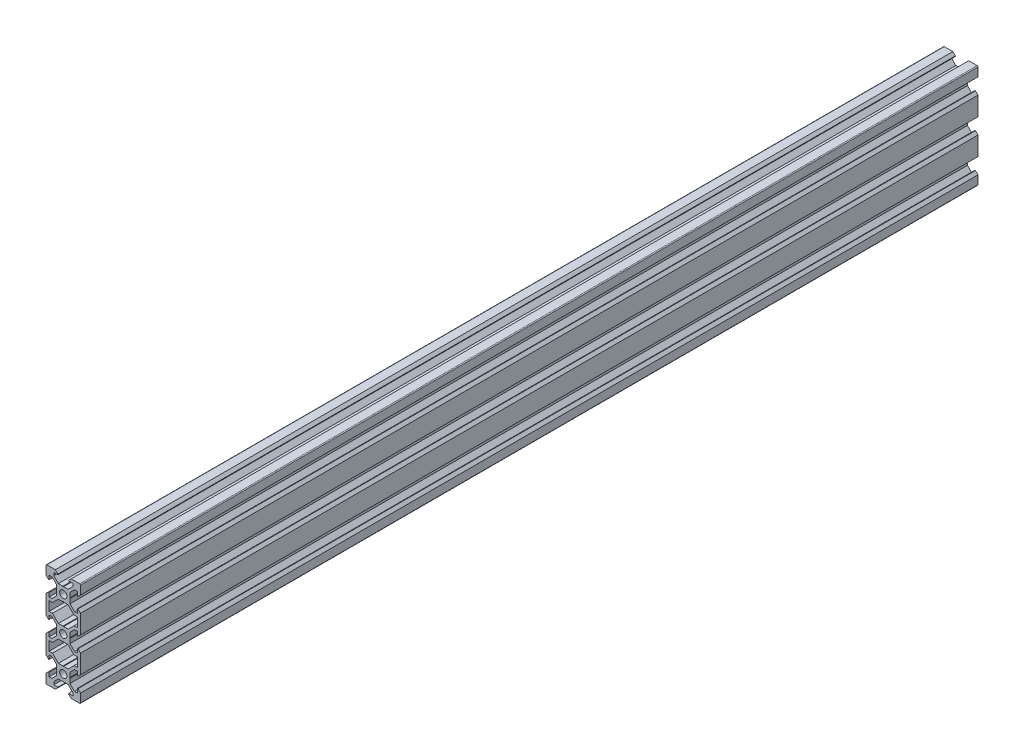
from build123d import *

# Parameters (mm, degrees)
BOSS_EXTRU_1_DEPTH = 520


with BuildPart() as part:
    # Esquisse1 → Boss.-Extru.1 (new body)
    with BuildSketch(Plane.XY):
        with BuildLine():
            Line((-9.5, 10), (-4.58, 10))
            Line((-4.58, 10), (-3.125, 8.545))
            Line((-3.125, 8.545), (-3.125, 8.2))
            Line((-3.125, 8.2), (-5.5, 8.2))
            Line((-5.5, 8.2), (-5.5, 6.560660172))
            Line((-5.5, 6.560660172), (-2.839339828, 3.9))
            Line((-2.839339828, 3.9), (-0.21, 3.9))
            Line((-0.21, 3.9), (0, 3.69))
            Line((0, 3.69), (0, 2.1))
            ThreePointArc((0, 2.1), (-2.1, 0), (0, -2.1))
            Line((0, -2.1), (0, -3.69))
            Line((0, -3.69), (-0.21, -3.9))
            Line((-0.21, -3.9), (-2.839339828, -3.9))
            Line((-2.839339828, -3.9), (-6.239339828, -7.3))
            Line((-6.239339828, -7.3), (-8.2, -7.3))
            Line((-8.2, -7.3), (-8.2, -12.7))
            Line((-8.2, -12.7), (-6.239339828, -12.7))
            Line((-6.239339828, -12.7), (-2.839339828, -16.1))
            Line((-2.839339828, -16.1), (-0.21, -16.1))
            Line((-0.21, -16.1), (0, -16.31))
            Line((0, -16.31), (0, -17.9))
            ThreePointArc((0, -17.9), (-2.1, -20), (0, -22.1))
            Line((0, -22.1), (0, -23.69))
            Line((0, -23.69), (-0.21, -23.9))
            Line((-0.21, -23.9), (-2.839339828, -23.9))
            Line((-2.839339828, -23.9), (-6.239339828, -27.3))
            Line((-6.239339828, -27.3), (-8.2, -27.3))
            Line((-8.2, -27.3), (-8.2, -32.7))
            Line((-8.2, -32.7), (-6.239339828, -32.7))
            Line((-6.239339828, -32.7), (-2.839339828, -36.1))
            Line((-2.839339828, -36.1), (-0.21, -36.1))
            Line((-0.21, -36.1), (0, -36.31))
            Line((0, -36.31), (0, -37.9))
            ThreePointArc((0, -37.9), (-2.1, -40), (0, -42.1))
            Line((0, -42.1), (0, -43.69))
            Line((0, -43.69), (-0.21, -43.9))
            Line((-0.21, -43.9), (-2.839339828, -43.9))
            Line((-2.839339828, -43.9), (-5.5, -46.560660172))
            Line((-5.5, -46.560660172), (-5.5, -48.2))
            Line((-5.5, -48.2), (-3.125, -48.2))
            Line((-3.125, -48.2), (-3.125, -48.545))
            Line((-3.125, -48.545), (-4.58, -50))
            Line((-4.58, -50), (-9.5, -50))
            ThreePointArc((-9.5, -50), (-9.853553391, -49.853553391), (-10, -49.5))
            Line((-10, -49.5), (-10, -44.58))
            Line((-10, -44.58), (-8.545, -43.125))
            Line((-8.545, -43.125), (-8.2, -43.125))
            Line((-8.2, -43.125), (-8.2, -45.5))
            Line((-8.2, -45.5), (-6.560660172, -45.5))
            Line((-6.560660172, -45.5), (-3.9, -42.839339828))
            Line((-3.9, -42.839339828), (-3.9, -40.21))
            Line((-3.9, -40.21), (-3.69, -40))
            Line((-3.69, -40), (-3.9, -39.79))
            Line((-3.9, -39.79), (-3.9, -37.160660172))
            Line((-3.9, -37.160660172), (-6.560660172, -34.5))
            Line((-6.560660172, -34.5), (-8.2, -34.5))
            Line((-8.2, -34.5), (-8.2, -36.875))
            Line((-8.2, -36.875), (-8.545, -36.875))
            Line((-8.545, -36.875), (-10, -35.42))
            Line((-10, -35.42), (-10, -24.58))
            Line((-10, -24.58), (-8.545, -23.125))
            Line((-8.545, -23.125), (-8.2, -23.125))
            Line((-8.2, -23.125), (-8.2, -25.5))
            Line((-8.2, -25.5), (-6.560660172, -25.5))
            Line((-6.560660172, -25.5), (-3.9, -22.839339828))
            Line((-3.9, -22.839339828), (-3.9, -20.21))
            Line((-3.9, -20.21), (-3.69, -20))
            Line((-3.69, -20), (-3.9, -19.79))
            Line((-3.9, -19.79), (-3.9, -17.160660172))
            Line((-3.9, -17.160660172), (-6.560660172, -14.5))
            Line((-6.560660172, -14.5), (-8.2, -14.5))
            Line((-8.2, -14.5), (-8.2, -16.875))
            Line((-8.2, -16.875), (-8.545, -16.875))
            Line((-8.545, -16.875), (-10, -15.42))
            Line((-10, -15.42), (-10, -4.58))
            Line((-10, -4.58), (-8.545, -3.125))
            Line((-8.545, -3.125), (-8.2, -3.125))
            Line((-8.2, -3.125), (-8.2, -5.5))
            Line((-8.2, -5.5), (-6.560660172, -5.5))
            Line((-6.560660172, -5.5), (-3.9, -2.839339828))
            Line((-3.9, -2.839339828), (-3.9, -0.21))
            Line((-3.9, -0.21), (-3.69, 0))
            Line((-3.69, 0), (-3.9, 0.21))
            Line((-3.9, 0.21), (-3.9, 2.839339828))
            Line((-3.9, 2.839339828), (-6.560660172, 5.5))
            Line((-6.560660172, 5.5), (-8.2, 5.5))
            Line((-8.2, 5.5), (-8.2, 3.125))
            Line((-8.2, 3.125), (-8.545, 3.125))
            Line((-8.545, 3.125), (-10, 4.58))
            Line((-10, 4.58), (-10, 9.5))
            ThreePointArc((-10, 9.5), (-9.853553391, 9.853553391), (-9.5, 10))
        make_face()
    boss_extru_1 = extrude(amount=BOSS_EXTRU_1_DEPTH)

    # Symétrie1: Boss.-Extru.1 across plane
    add(boss_extru_1.mirror(Plane(origin=(0, 3.69, 520), x_dir=(0, 0, 1), z_dir=(-1, 0, 0))))


solid = part.part
